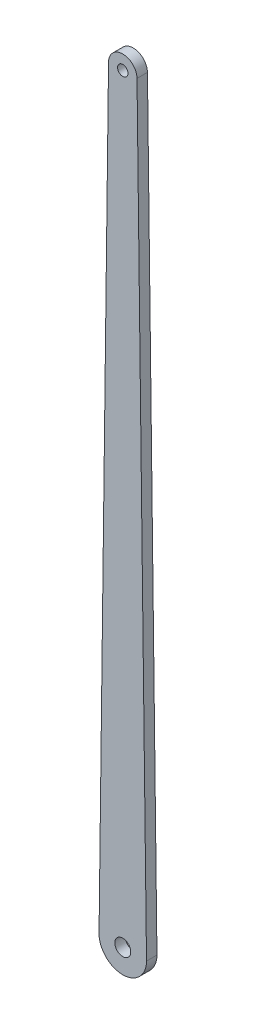
from build123d import *

# Parameters (mm, degrees)
SKETCH1_R           = 2.75
BOSS_EXTRUDE1_DEPTH = 5.5


with BuildPart() as part:
    # Sketch1 → Boss-Extrude1 (new body)
    # profile 1 of 3: a face of its own
    with BuildSketch(Plane.XY):
        with BuildLine():
            ThreePointArc((-12.496095275, 0.312414586), (0, 12.5), (12.496095275, 0.312414586))
            Line((12.496095275, 0.312414586), (7.499414268, 400.093731696))
            ThreePointArc((7.499414268, 400.093731696), (0, 407.5), (-7.499414268, 400.093731696))
            Line((-7.499414268, 400.093731696), (-12.496095275, 0.312414586))
        make_face()
        with Locations((0, 400)):
            Circle(SKETCH1_R, mode=Mode.SUBTRACT)
    # profile 2 of 3: a face of its own
    with BuildSketch(Plane.XY):
        with BuildLine():
            ThreePointArc((-4.2, 0), (0, 4.2), (4.2, 0))
            Line((4.2, 0), (12.5, 0))
            Line((12.5, 0), (12.496095275, 0.312414586))
            ThreePointArc((12.496095275, 0.312414586), (0, 12.5), (-12.496095275, 0.312414586))
            Line((-12.496095275, 0.312414586), (-12.5, 0))
            Line((-12.5, 0), (-4.2, 0))
        make_face()
    # profile 3 of 3: a face of its own
    with BuildSketch(Plane.XY):
        with BuildLine():
            Line((12.5, 0), (4.2, 0))
            ThreePointArc((4.2, 0), (0, -4.2), (-4.2, 0))
            Line((-4.2, 0), (-12.5, 0))
            ThreePointArc((-12.5, 0), (0, -12.5), (12.5, 0))
        make_face()
    extrude(amount=BOSS_EXTRUDE1_DEPTH)


solid = part.part
